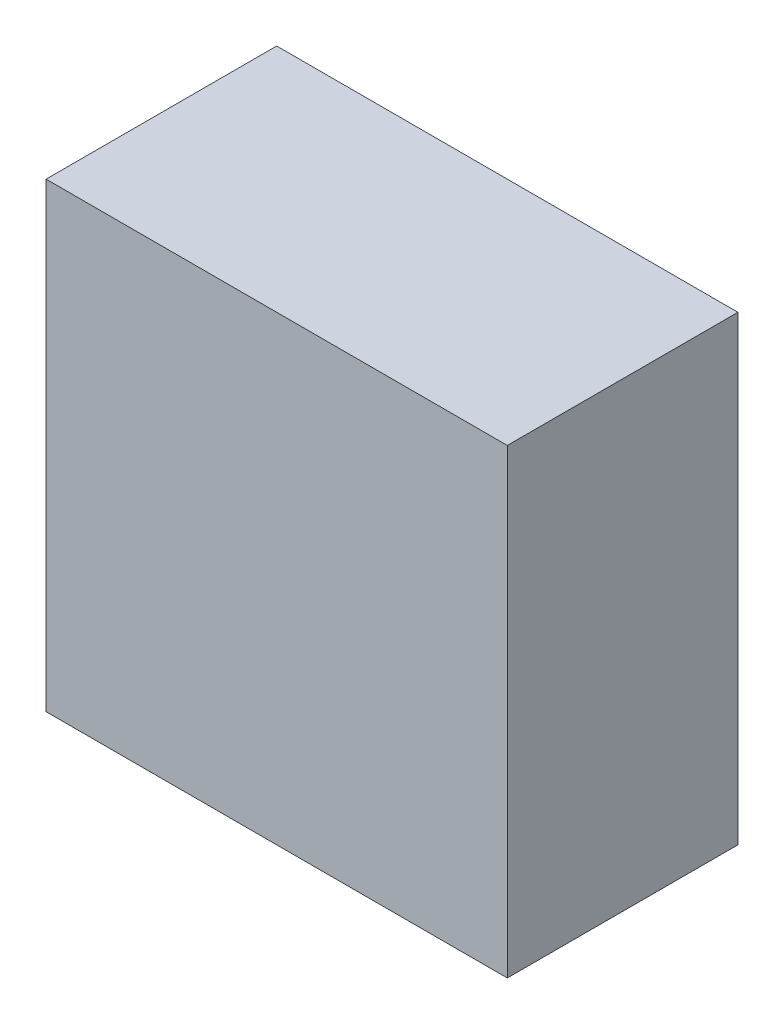
from build123d import *

# Parameters (mm, degrees)
SKICA1_W                 = 20
SKICA1_H                 = 20
P_IDAT_VYSUNUT_M1_DEPTH  = 10
SKICA2_W                 = 17
SKICA2_H                 = 17
ODEBRAT_VYSUNUT_M1_DEPTH = 7.5
SKICA3_R                 = 2.65
P_IDAT_VYSUNUT_M2_DEPTH  = 7.5
ODEBRAT_VYSUNUT_M2_DEPTH = 7.5


with BuildPart() as part:
    # Skica1 → Přidat vysunutím1 (new body)
    with BuildSketch(Plane.XY):
        Rectangle(SKICA1_W, SKICA1_H)
    extrude(amount=P_IDAT_VYSUNUT_M1_DEPTH)

    # Skica2 → Odebrat vysunutím1 (cut)
    with BuildSketch(Plane(origin=(0, 0, 0), x_dir=(-1, 0, 0), z_dir=(0, 0, -1))):
        Rectangle(SKICA2_W, SKICA2_H)
    extrude(amount=-ODEBRAT_VYSUNUT_M1_DEPTH, mode=Mode.SUBTRACT)

    # Skica3 → Přidat vysunutím2 (add)
    with BuildSketch(Plane(origin=(0, 0, 7.5), x_dir=(-1, 0, 0), z_dir=(0, 0, -1))):
        with Locations(Location((0, 0, 0), (0, 0, 180))):
            Circle(SKICA3_R)
    extrude(amount=P_IDAT_VYSUNUT_M2_DEPTH)

    # Skica4 → Odebrat vysunutím2 (cut)
    with BuildSketch(Plane(origin=(0, 0, 0), x_dir=(-1, 0, 0), z_dir=(0, 0, -1))):
        Polygon((-0.585, 2.05), (0.585, 2.05), (0.585, 0.585), (2.05, 0.585), (2.05, -0.585), (0.585, -0.585), (0.585, -2.05), (-0.585, -2.05), (-0.585, -0.585), (-2.05, -0.585), (-2.05, 0.585), (-0.585, 0.585), align=None)
    extrude(amount=-ODEBRAT_VYSUNUT_M2_DEPTH, mode=Mode.SUBTRACT)


solid = part.part
